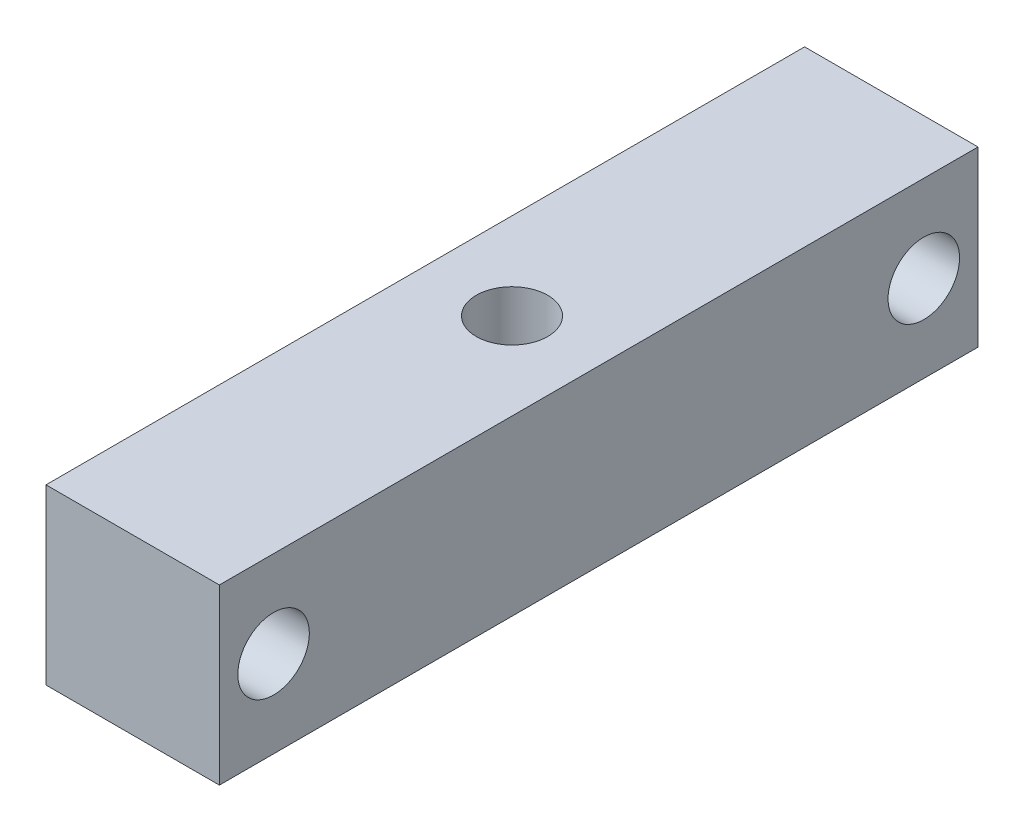
from build123d import *

# Parameters (mm, degrees)
SKETCH_1_W          = 8
SKETCH_1_H          = 8
EXTRUDE_1_DEPTH     = 35
SKETCH_2_R          = 1.65
CUT_EXTRUDE_1_DEPTH = 40
SKETCH_3_R          = 1.65
CUT_EXTRUDE_2_DEPTH = 40


with BuildPart() as part:
    # 草图1 → 凸台-拉伸1 (new body)
    with BuildSketch(Plane.XY):
        with Locations((4, 4)):
            Rectangle(SKETCH_1_W, SKETCH_1_H)
    extrude(amount=EXTRUDE_1_DEPTH)

    # 草图2 → 切除-拉伸1 (cut)
    with BuildSketch(Plane(origin=(8, 0, 0), x_dir=(0, 0, -1), z_dir=(1, 0, 0))):
        with Locations(Location((-32.5, 4, 0), (0, 0, 90))):
            Circle(SKETCH_2_R)
        with Locations(Location((-2.5, 4, 0), (0, 0, 90))):
            Circle(SKETCH_2_R)
    extrude(amount=-CUT_EXTRUDE_1_DEPTH, mode=Mode.SUBTRACT)

    # 草图3 → 切除-拉伸2 (cut)
    with BuildSketch(Plane(origin=(0, 8, 0), x_dir=(1, 0, 0), z_dir=(0, 1, 0))):
        with Locations(Location((4, -17.5, 0), (0, 0, 270))):
            Circle(SKETCH_3_R)
    extrude(amount=-CUT_EXTRUDE_2_DEPTH, mode=Mode.SUBTRACT)


solid = part.part
